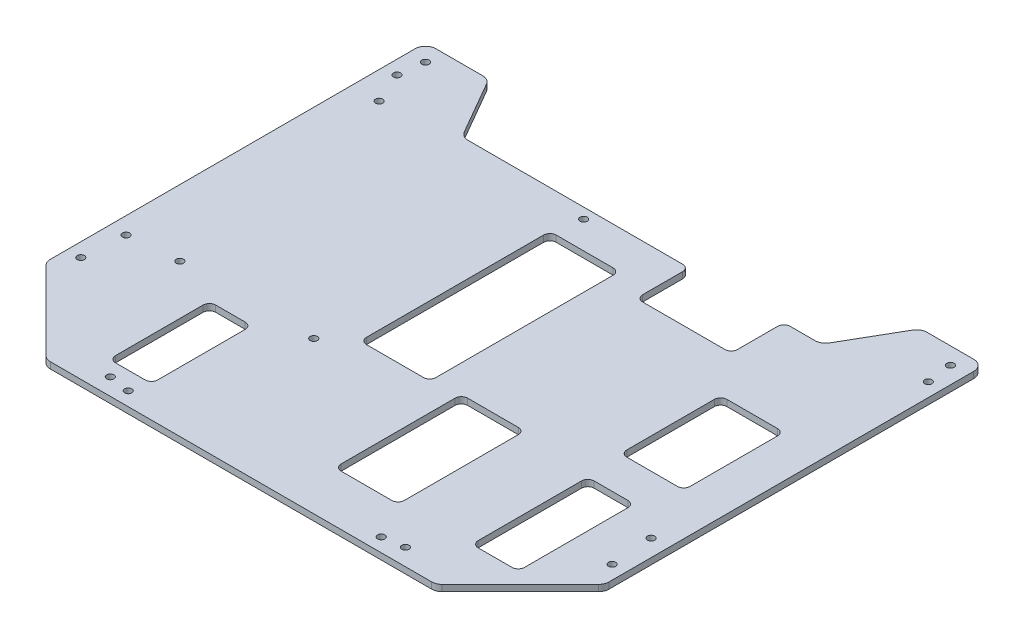
from build123d import *

# Parameters (mm, degrees)
BOSS_EXTRU_1_DEPTH      = 3
CONG_1_R                = 5
ESQUISSE2_R             = 1
ESQUISSE2_R_2           = 1.5
ENL_V_MAT_EXTRU_1_DEPTH = 257.837010573
D_GAGEMENT_M31_D        = 3.4
ESQUISSE5_W             = 45
ESQUISSE5_H             = 25
ESQUISSE5_W_2           = 33
ESQUISSE5_H_2           = 90
ESQUISSE5_W_3           = 22
ESQUISSE5_H_3           = 55
ESQUISSE5_W_4           = 30
ESQUISSE5_H_4           = 60
ESQUISSE5_W_5           = 20
ESQUISSE5_H_5           = 47.5
ENL_V_MAT_EXTRU_2_DEPTH = 257.837010573
CONG_2_R                = 3


with BuildPart() as part:
    # Esquisse1 → Boss.-Extru.1 (new body)
    with BuildSketch(Plane(origin=(0, 0, 0), x_dir=(1, 0, 0), z_dir=(0, 1, 0))):
        Polygon((-92.5, 0), (92.5, 0), (132.5, 40), (132.5, 220), (102.5, 220), (85.179491924, 190), (-85.179491924, 190), (-102.5, 220), (-132.5, 220), (-132.5, 40), align=None)
    extrude(amount=BOSS_EXTRU_1_DEPTH)

    # Congé1
    cong_1_edges = [part.edges().sort_by_distance(p)[0] for p in [
        (92.5, 1.5, 0),
        (-92.5, 1.5, 0),
        (-132.5, 1.5, -40),
        (-132.5, 1.5, -220),
        (-102.5, 1.5, -220),
        (-85.179491924, 1.5, -190),
        (85.179491924, 1.5, -190),
        (102.5, 1.5, -220),
        (132.5, 1.5, -220),
        (132.5, 1.5, -40),
    ]]
    fillet(cong_1_edges, radius=CONG_1_R)

    # Esquisse2 → Enlèv. mat.-Extru.1 (cut, through all)
    with BuildSketch(Plane.XZ):
        with Locations(Location((-70, -8, 0), (0, 0, 270))):
            Circle(ESQUISSE2_R)
        with Locations(Location((-124.5, -70, 0), (0, 0, 270))):
            Circle(ESQUISSE2_R)
        with Locations(Location((-124.5, -212, 0), (0, 0, 270))):
            Circle(ESQUISSE2_R)
        with Locations(Location((124.5, -212, 0), (0, 0, 90))):
            Circle(ESQUISSE2_R)
        with Locations(Location((124.5, -70, 0), (0, 0, 90))):
            Circle(ESQUISSE2_R)
        with Locations(Location((70, -8, 0), (0, 0, 90))):
            Circle(ESQUISSE2_R)
        with Locations(Location((126, -50, 0), (0, 0, 270))):
            Circle(ESQUISSE2_R_2)
        with Locations(Location((126, -200, 0), (0, 0, 270))):
            Circle(ESQUISSE2_R_2)
        with Locations(Location((-60, -6.5, 0), (0, 0, 270))):
            Circle(ESQUISSE2_R_2)
        with Locations(Location((60, -6.5, 0), (0, 0, 270))):
            Circle(ESQUISSE2_R_2)
        with Locations(Location((-126, -50, 0), (0, 0, 270))):
            Circle(ESQUISSE2_R_2)
        with Locations(Location((-126, -200, 0), (0, 0, 270))):
            Circle(ESQUISSE2_R_2)
        with Locations(Location((-119.5, -185, 0), (0, 0, 270))):
            Circle(ESQUISSE2_R_2)
        with Locations(Location((-22.5, -185, 0), (0, 0, 270))):
            Circle(ESQUISSE2_R_2)
        with Locations(Location((-101, -72, 0), (0, 0, 270))):
            Circle(ESQUISSE2_R_2)
        with Locations(Location((-37.5, -72, 0), (0, 0, 270))):
            Circle(ESQUISSE2_R_2)
    extrude(amount=-ENL_V_MAT_EXTRU_1_DEPTH, mode=Mode.SUBTRACT)

    # Dégagement M31 (through all)
    with Locations(Plane(origin=(0, 0, 0), x_dir=(-1, 0, 0), z_dir=(0, -1, 0))):
        with Locations((-70, 8), (-124.5, 70), (-124.5, 212), (124.5, 212), (124.5, 70), (70, 8), (-126, 200), (-126, 50), (-60, 6.5), (60, 6.5), (126, 50), (126, 200), (101, 72), (37.5, 72), (119.5, 185), (22.5, 185)):
            Hole(D_GAGEMENT_M31_D / 2)

    # Esquisse5 → Enlèv. mat.-Extru.2 (cut, through all)
    with BuildSketch(Plane.XZ):
        with Locations((45, -177.5)):
            Rectangle(ESQUISSE5_W, ESQUISSE5_H)
        with Locations((-9, -127)):
            Rectangle(ESQUISSE5_W_2, ESQUISSE5_H_2)
        with Locations((95.5, -52.5)):
            Rectangle(ESQUISSE5_W_3, ESQUISSE5_H_3)
        with Locations((35.5, -54)):
            Rectangle(ESQUISSE5_W_4, ESQUISSE5_H_4)
        with Locations((-67.5, -38.75)):
            Rectangle(ESQUISSE5_W_5, ESQUISSE5_H_5)
        with Locations((97.5, -121.25)):
            Rectangle(ESQUISSE5_W_4, ESQUISSE5_H_5)
    extrude(amount=-ENL_V_MAT_EXTRU_2_DEPTH, mode=Mode.SUBTRACT)

    # Congé2
    cong_2_edges = [part.edges().sort_by_distance(p)[0] for p in [
        (-77.5, 1.5, -62.5),
        (-77.5, 1.5, -15),
        (-57.5, 1.5, -15),
        (-57.5, 1.5, -62.5),
        (84.5, 1.5, -80),
        (84.5, 1.5, -25),
        (106.5, 1.5, -25),
        (106.5, 1.5, -80),
        (20.5, 1.5, -84),
        (20.5, 1.5, -24),
        (50.5, 1.5, -24),
        (50.5, 1.5, -84),
        (-25.5, 1.5, -172),
        (-25.5, 1.5, -82),
        (7.5, 1.5, -82),
        (7.5, 1.5, -172),
        (82.5, 1.5, -145),
        (82.5, 1.5, -97.5),
        (112.5, 1.5, -97.5),
        (112.5, 1.5, -145),
        (22.5, 1.5, -190),
        (22.5, 1.5, -165),
        (67.5, 1.5, -165),
        (67.5, 1.5, -190),
    ]]
    fillet(cong_2_edges, radius=CONG_2_R)


solid = part.part
